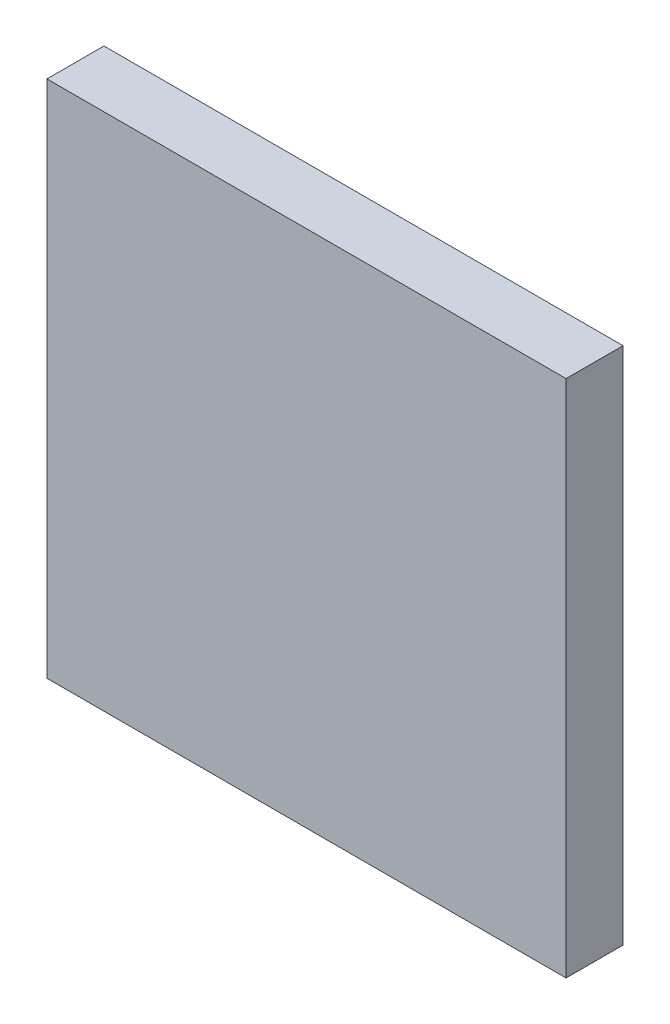
from build123d import *

# Parameters (mm, degrees)
SKETCH1_W           = 41
SKETCH1_H           = 41
BOSS_EXTRUDE1_DEPTH = 4.5


with BuildPart() as part:
    # Sketch1 → Boss-Extrude1 (new body)
    with BuildSketch(Plane.XY):
        Rectangle(SKETCH1_W, SKETCH1_H)
    extrude(amount=BOSS_EXTRUDE1_DEPTH)


solid = part.part
